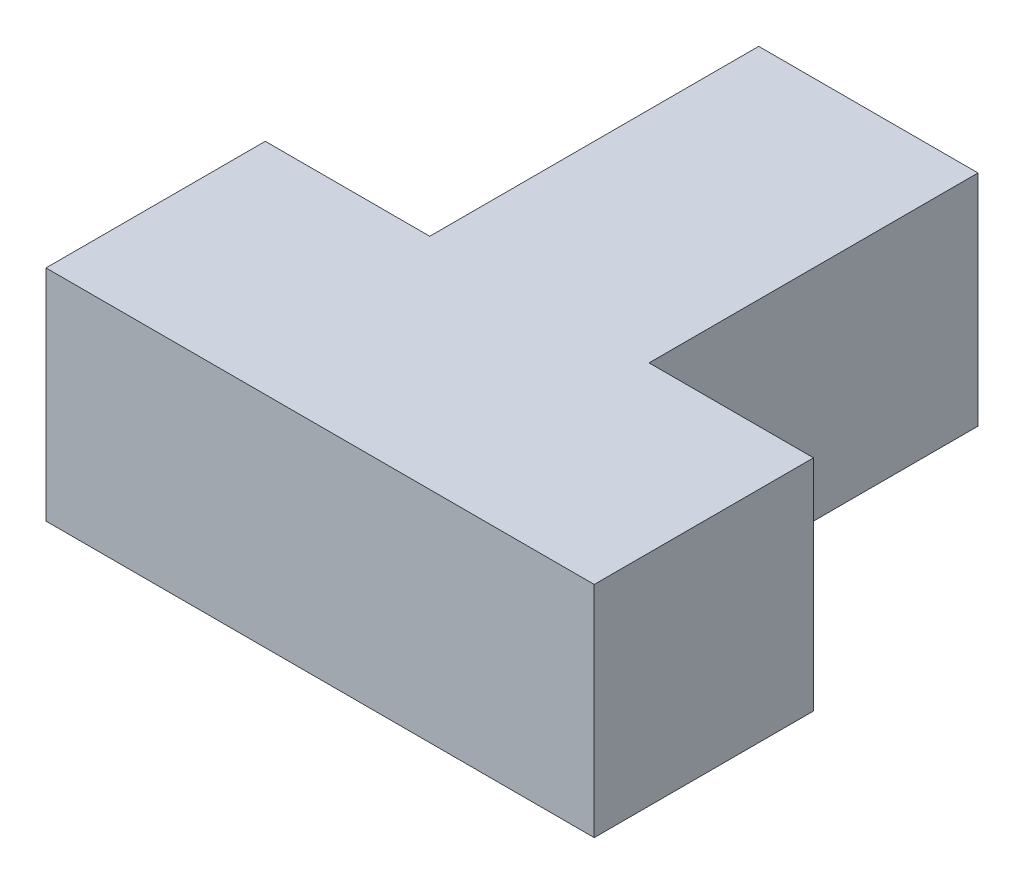
from build123d import *

# Parameters (mm, degrees)
BOSS_EXTRUDE1_DEPTH = 20


with BuildPart() as part:
    # Sketch1 → Boss-Extrude1 (new body)
    with BuildSketch(Plane(origin=(0, 0, 0), x_dir=(1, 0, 0), z_dir=(0, 1, 0))):
        Polygon((-25, -25), (25, -25), (25, -5), (10, -5), (10, 25), (-10, 25), (-10, -5), (-25, -5), align=None)
    extrude(amount=BOSS_EXTRUDE1_DEPTH)


solid = part.part
